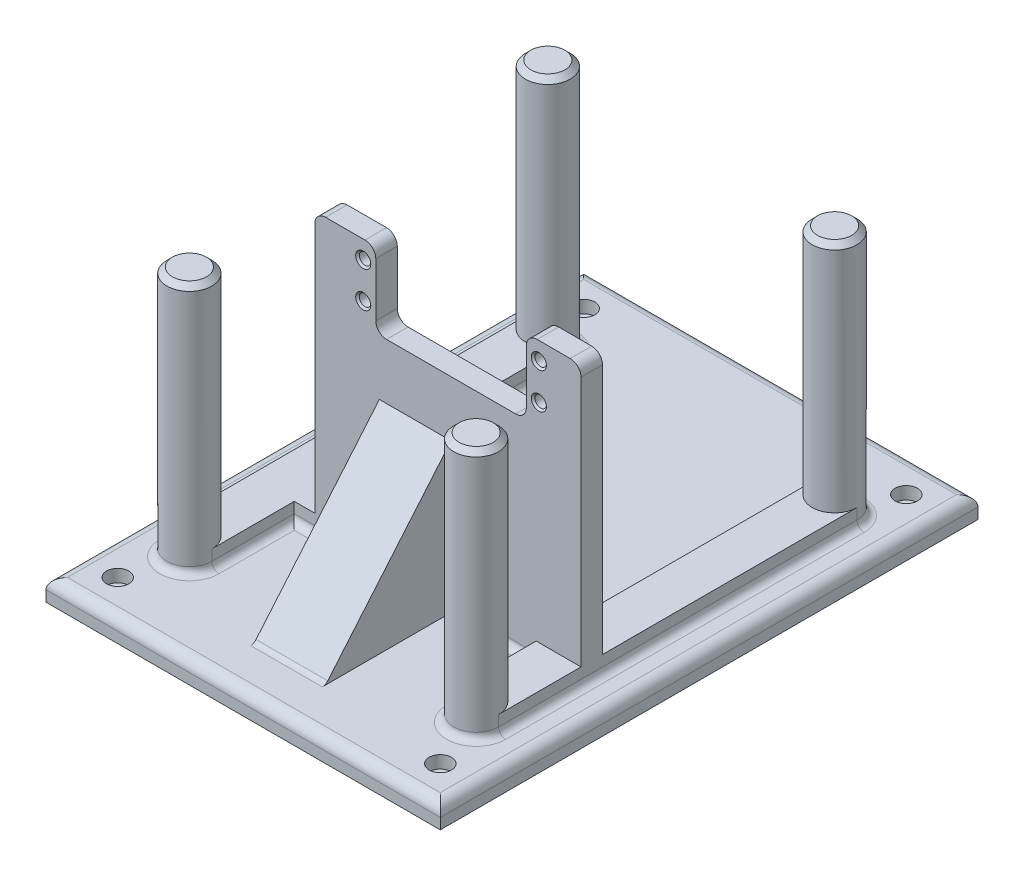
from build123d import *

# Parameters (mm, degrees)
SKETCH_1_W               = 110
SKETCH_1_H               = 150
EXTRUDE_1_DEPTH          = 6
SKETCH_2_R               = 6.25
EXTRUDE_2_DEPTH          = 70
SKETCH_3_R               = 1.7
CUT_EXTRUDE_1_DEPTH      = 117.404467268
SKETCH_4_R               = 3.1
CUT_EXTRUDE_2_DEPTH      = 3.5
SKETCH_5_W               = 74.25
SKETCH_5_H               = 6
EXTRUDE_3_DEPTH          = 78
CUT_EXTRUDE_8_DEPTH      = 5
CUT_EXTRUDE_8_DEPTH_BACK = 7
SKETCH_7_R               = 1.6
SKETCH_7_W               = 42
SKETCH_7_H               = 21
SKETCH_10_W              = 12.5
SKETCH_10_H              = 100
EXTRUDE_4_DEPTH          = 5
RIB_3_REACH              = 127.324
SKETCH_8_WALL_W          = 306.935743114
SKETCH_8_WALL_H          = 20
FILLET_5_R               = 2
FILLET_4_R               = 3
CHAMFER_1_SIZE           = 1.5
CHAMFER_2_SIZE           = 0.5


with BuildPart() as part:
    # 草图1 → 凸台-拉伸1 (new body)
    with BuildSketch(Plane(origin=(0, 0, 0), x_dir=(1, 0, 0), z_dir=(0, 1, 0))):
        Rectangle(SKETCH_1_W, SKETCH_1_H)
    extrude(amount=EXTRUDE_1_DEPTH)

    # 草图2 → 凸台-拉伸2 (add)
    with BuildSketch(Plane(origin=(0, 6, 0), x_dir=(1, 0, 0), z_dir=(0, 1, 0))):
        with Locations(Location((-40, 50, 0), (0, 0, 90))):
            Circle(SKETCH_2_R)
        with Locations(Location((40, 50, 0), (0, 0, 90))):
            Circle(SKETCH_2_R)
        with Locations(Location((40, -50, 0), (0, 0, 90))):
            Circle(SKETCH_2_R)
        with Locations(Location((-40, -50, 0), (0, 0, 90))):
            Circle(SKETCH_2_R)
    extrude(amount=EXTRUDE_2_DEPTH)

    # 草图3 → 切除-拉伸1 (cut, through all)
    with BuildSketch(Plane(origin=(0, 6, 0), x_dir=(1, 0, 0), z_dir=(0, 1, 0))):
        with Locations(Location((-45, 65, 0), (0, 0, 270))):
            Circle(SKETCH_3_R)
        with Locations(Location((-45, -65, 0), (0, 0, 90))):
            Circle(SKETCH_3_R)
        with Locations(Location((45, -65, 0), (0, 0, 270))):
            Circle(SKETCH_3_R)
        with Locations(Location((45, 65, 0), (0, 0, 90))):
            Circle(SKETCH_3_R)
    extrude(amount=-CUT_EXTRUDE_1_DEPTH, mode=Mode.SUBTRACT)

    # 草图4 → 切除-拉伸2 (cut)
    with BuildSketch(Plane(origin=(0, 6, 0), x_dir=(1, 0, 0), z_dir=(0, 1, 0))):
        with Locations(Location((-45, 65, 0), (0, 0, 270))):
            Circle(SKETCH_4_R)
        with Locations(Location((45, 65, 0), (0, 0, 90))):
            Circle(SKETCH_4_R)
        with Locations(Location((45, -65, 0), (0, 0, 270))):
            Circle(SKETCH_4_R)
        with Locations(Location((-45, -65, 0), (0, 0, 90))):
            Circle(SKETCH_4_R)
    extrude(amount=-CUT_EXTRUDE_2_DEPTH, mode=Mode.SUBTRACT)

    # 草图5 → 凸台-拉伸3 (add)
    with BuildSketch(Plane(origin=(0, 6, 0), x_dir=(1, 0, 0), z_dir=(0, 1, 0))):
        with Locations((9.125, -24)):
            Rectangle(SKETCH_5_W, SKETCH_5_H)
    extrude(amount=EXTRUDE_3_DEPTH)

    # 草图7 → 切除-拉伸8 (cut, two sides: drawn at the far end of the back side and taken through both)
    with BuildSketch(Plane.XY.offset(27).offset(-CUT_EXTRUDE_8_DEPTH_BACK)):
        with Locations(Location((-14.5, 69, 0), (0, 0, 180))):
            Circle(SKETCH_7_R)
        with Locations(Location((-14.5, 79, 0), (0, 0, 180))):
            Circle(SKETCH_7_R)
        with Locations(Location((34.5, 69, 0), (0, 0, 180))):
            Circle(SKETCH_7_R)
        with Locations(Location((34.5, 79, 0), (0, 0, 180))):
            Circle(SKETCH_7_R)
        with Locations((10, 73.5)):
            Rectangle(SKETCH_7_W, SKETCH_7_H)
    extrude(amount=CUT_EXTRUDE_8_DEPTH + CUT_EXTRUDE_8_DEPTH_BACK, mode=Mode.SUBTRACT)

    # 草图10 → 凸台-拉伸4 (add)
    with BuildSketch(Plane(origin=(0, 6, 0), x_dir=(1, 0, 0), z_dir=(0, 1, 0))):
        Polygon((-33.75, -50), (-33.75, -27), (-28, -27), (-28, -21), (-33.75, -21), (-33.75, 50), (-46.25, 50), (-46.25, -50), align=None)
        with Locations((40, 0)):
            Rectangle(SKETCH_10_W, SKETCH_10_H)
    extrude(amount=EXTRUDE_4_DEPTH)

    # 草图8 wall → 筋3 (add, up to next)
    with BuildSketch(Plane(origin=(0, 26.75, 44.5), x_dir=(0, -0.764433319597, 0.64470279966), z_dir=(0, -0.64470279966, -0.764433319597)), mode=Mode.PRIVATE) as rib_3_sk1:
        Rectangle(SKETCH_8_WALL_W, SKETCH_8_WALL_H)
    rib_3_tool1 = extrude(rib_3_sk1.sketch, amount=RIB_3_REACH, mode=Mode.PRIVATE) - part.part
    add(rib_3_tool1.solids().sort_by_distance((0, 26.75, 44.5))[0])

    # 圆角5
    fillet_5_edges = [part.edges().sort_by_distance(p)[0] for p in [
        (35.580582618, 6, -54.419417382),
        (-44.419417382, 6, -54.419417382),
        (0, 6, 21),
        (40, 6, 56.25),
        (-46.25, 6, 0),
        (-33.75, 6, 38.5),
        (-33.75, 6, -14.5),
        (-40, 6, 56.25),
        (33.75, 6, 38.5),
        (33.75, 6, -14.5),
        (21.875, 6, 27),
        (0, 6, 62),
        (-21.875, 6, 27),
        (46.25, 6, 0),
    ]]
    fillet(fillet_5_edges, radius=FILLET_5_R)

    # 圆角4
    fillet_4_edges = [part.edges().sort_by_distance(p)[0] for p in [
        (-11, 63, 24),
        (31, 63, 24),
        (0, 6, 75),
        (-55, 6, 0),
        (0, 6, -75),
        (-28, 84, 24),
        (46.25, 84, 24),
        (55, 6, 0),
        (31, 84, 24),
        (-11, 84, 24),
    ]]
    fillet(fillet_4_edges, radius=FILLET_4_R)

    # 倒角1
    chamfer_1_edges = [part.edges().sort_by_distance(p)[0] for p in [
        (-40, 76, 56.25),
        (40, 76, 56.25),
        (40, 76, -43.75),
        (-40, 76, -43.75),
    ]]
    chamfer(chamfer_1_edges, length=CHAMFER_1_SIZE)

    # 倒角2
    chamfer_2_edges = [part.edges().sort_by_distance(p)[0] for p in [
        (36.1, 79, 27),
        (36.1, 79, 21),
        (36.1, 69, 27),
        (36.1, 69, 21),
        (-12.9, 79, 27),
        (-12.9, 79, 21),
        (-12.9, 69, 27),
        (-12.9, 69, 21),
    ]]
    chamfer(chamfer_2_edges, length=CHAMFER_2_SIZE)


solid = part.part
